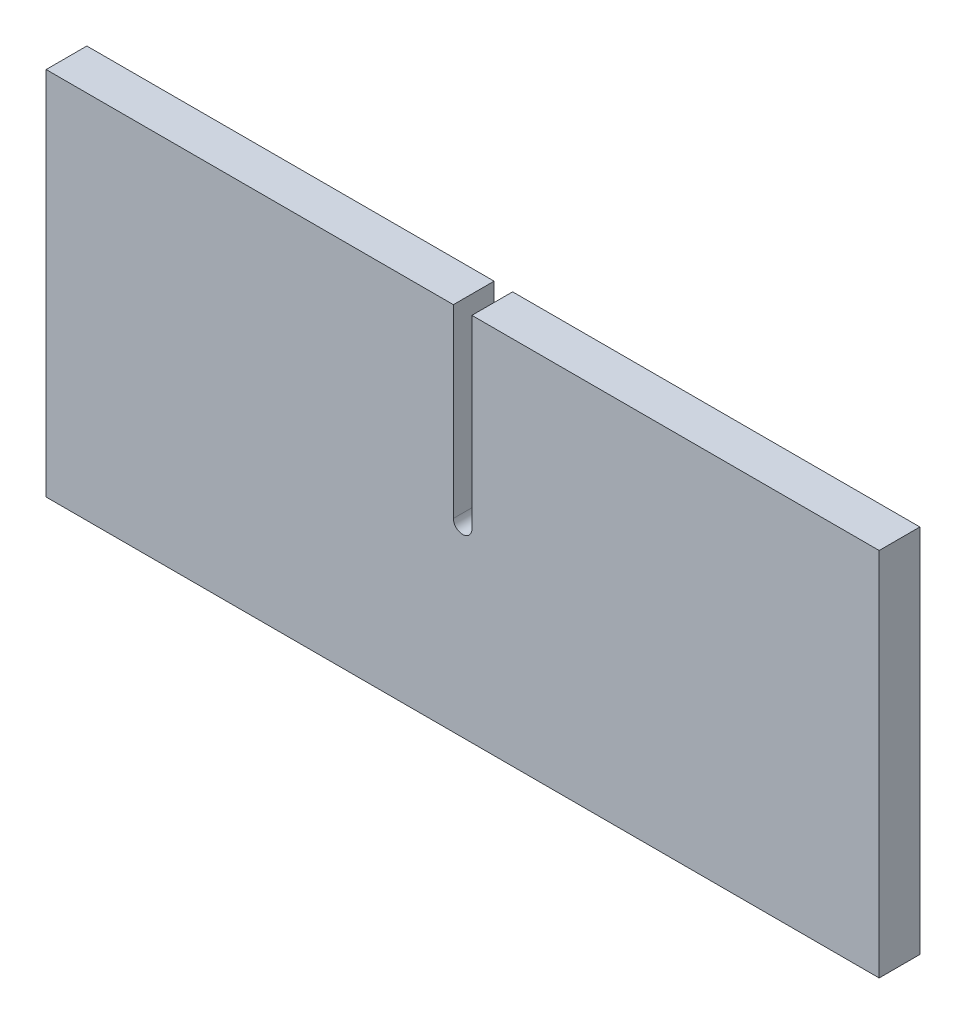
from build123d import *

# Parameters (mm, degrees)
BOSS_EXTRU_1_DEPTH = 22


with BuildPart() as part:
    # Esquisse1 → Boss.-Extru.1 (new body)
    with BuildSketch(Plane.XY):
        with BuildLine():
            Line((-225, 100), (-5, 100))
            Line((-5, 100), (-5, 0))
            ThreePointArc((-5, 0), (0, -5), (5, 0))
            Line((5, 0), (5, 100))
            Line((5, 100), (225, 100))
            Line((225, 100), (225, -100))
            Line((225, -100), (-225, -100))
            Line((-225, -100), (-225, 100))
        make_face()
    extrude(amount=BOSS_EXTRU_1_DEPTH)


solid = part.part
